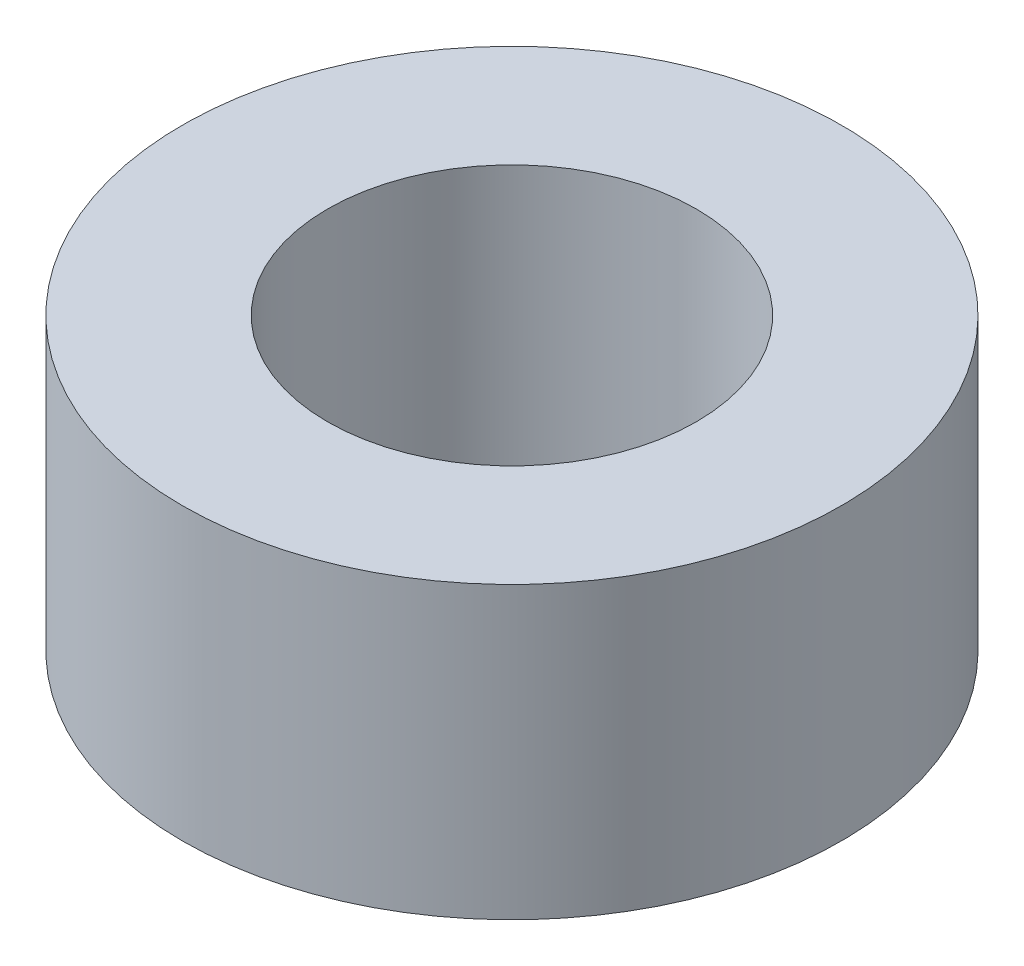
from build123d import *

# Parameters (mm, degrees)
SKETCH_2_R          = 22.7
SKETCH_2_R_2        = 12.7
EXTRUDE_1_DEPTH     = 10
EXTRUDE_START       = -20
EXTRUDE_2_DEPTH     = 5
SKETCH_4_R          = 4
CUT_EXTRUDE_2_DEPTH = 5


with BuildPart() as part:
    # Эскиз2 → Бобышка-Вытянуть1 (new, symmetric)
    with BuildSketch(Plane(origin=(0, 0, 0), x_dir=(1, 0, 0), z_dir=(0, 1, 0))):
        with Locations(Location((0, 0, 0), (0, 0, 270))):
            Circle(SKETCH_2_R)
        with Locations(Location((0, 0, 0), (0, 0, 270))):
            Circle(SKETCH_2_R_2, mode=Mode.SUBTRACT)
    extrude(amount=EXTRUDE_1_DEPTH, both=True)

    # Эскиз3 → Бобышка-Вытянуть2 (add)
    with BuildSketch(Plane(origin=(0, 0, 0), x_dir=(0, 0, -1), z_dir=(1, 0, 0)).offset(EXTRUDE_START)):
        Polygon((5.773502692, 0), (2.886751346, 5), (-2.886751346, 5), (-5.773502692, 0), (-2.886751346, -5), (2.886751346, -5), align=None)
    extrude(amount=-EXTRUDE_2_DEPTH)

    # Эскиз4 → Вырез-Вытянуть2 (cut)
    with BuildSketch(Plane.ZY.offset(25)):
        Circle(SKETCH_4_R)
    extrude(amount=-CUT_EXTRUDE_2_DEPTH, mode=Mode.SUBTRACT)


solid = part.part
